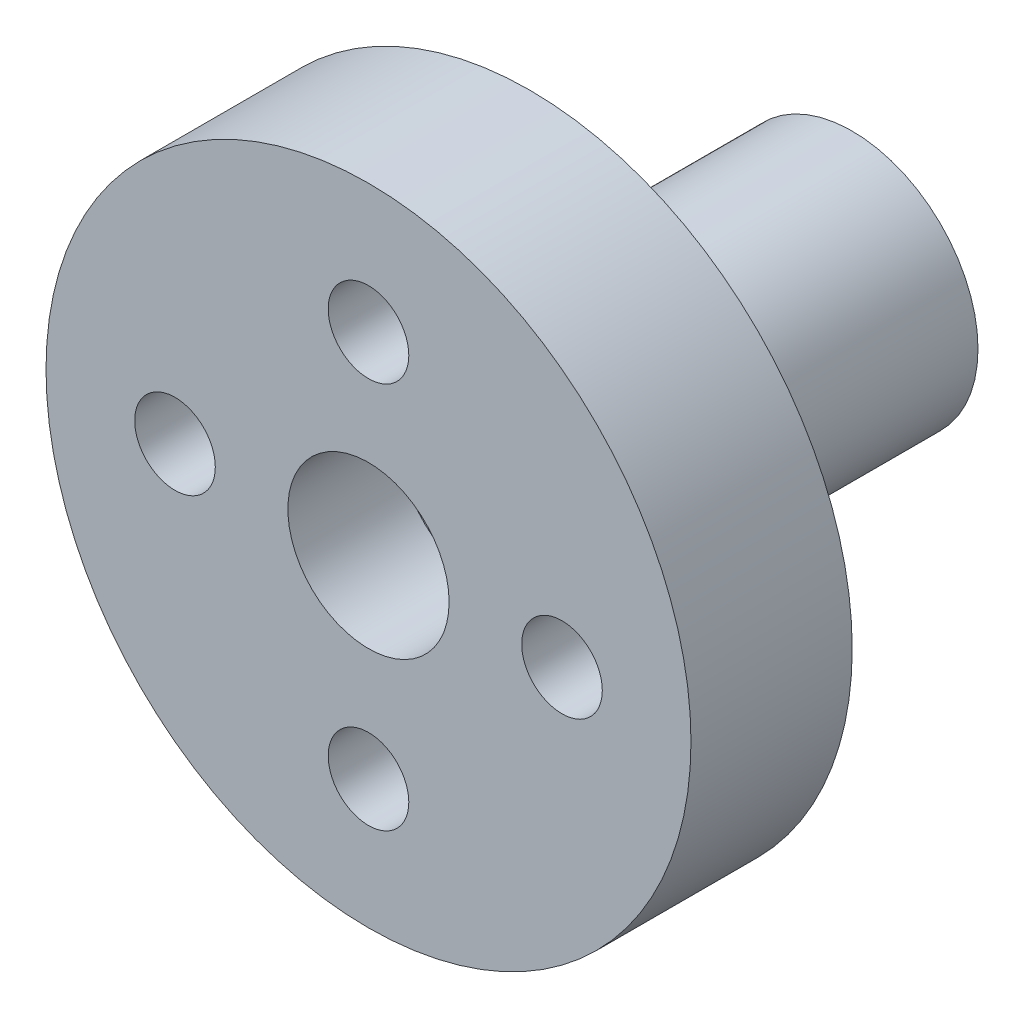
from build123d import *

# Parameters (mm, degrees)
SKETCH_1_R          = 3.9
SKETCH_1_R_2        = 2.65
EXTRUDE_1_DEPTH     = 10
SKETCH_3_R          = 10
EXTRUDE_2_DEPTH     = 5
SKETCH_5_R          = 1.25
CUT_EXTRUDE_1_DEPTH = 3
SKETCH_7_R          = 2.5
CUT_EXTRUDE_2_DEPTH = 3.5


with BuildPart() as part:
    # 草图1 → 凸台-拉伸1 (new body)
    with BuildSketch(Plane.XY):
        with Locations((0, 51.778341992)):
            Circle(SKETCH_1_R)
        with Locations((0, 51.778341992)):
            Circle(SKETCH_1_R_2, mode=Mode.SUBTRACT)
    extrude(amount=EXTRUDE_1_DEPTH)

    # 草图3 → 凸台-拉伸2 (add)
    with BuildSketch(Plane.XY.offset(10)):
        with Locations((0, 51.778341992)):
            Circle(SKETCH_3_R)
    extrude(amount=EXTRUDE_2_DEPTH)

    # 草图5 → 切除-拉伸1 (cut)
    with BuildSketch(Plane.XY.offset(15)):
        with Locations((6, 51.778341992)):
            Circle(SKETCH_5_R)
        with Locations((0, 57.778341992)):
            Circle(SKETCH_5_R)
        with Locations((0, 45.778341992)):
            Circle(SKETCH_5_R)
        with Locations((-6, 51.778341992)):
            Circle(SKETCH_5_R)
    extrude(amount=-CUT_EXTRUDE_1_DEPTH, mode=Mode.SUBTRACT)

    # 草图7 → 切除-拉伸2 (cut)
    with BuildSketch(Plane.XY.offset(15)):
        with Locations((0, 51.778341992)):
            Circle(SKETCH_7_R)
    extrude(amount=-CUT_EXTRUDE_2_DEPTH, mode=Mode.SUBTRACT)


solid = part.part
